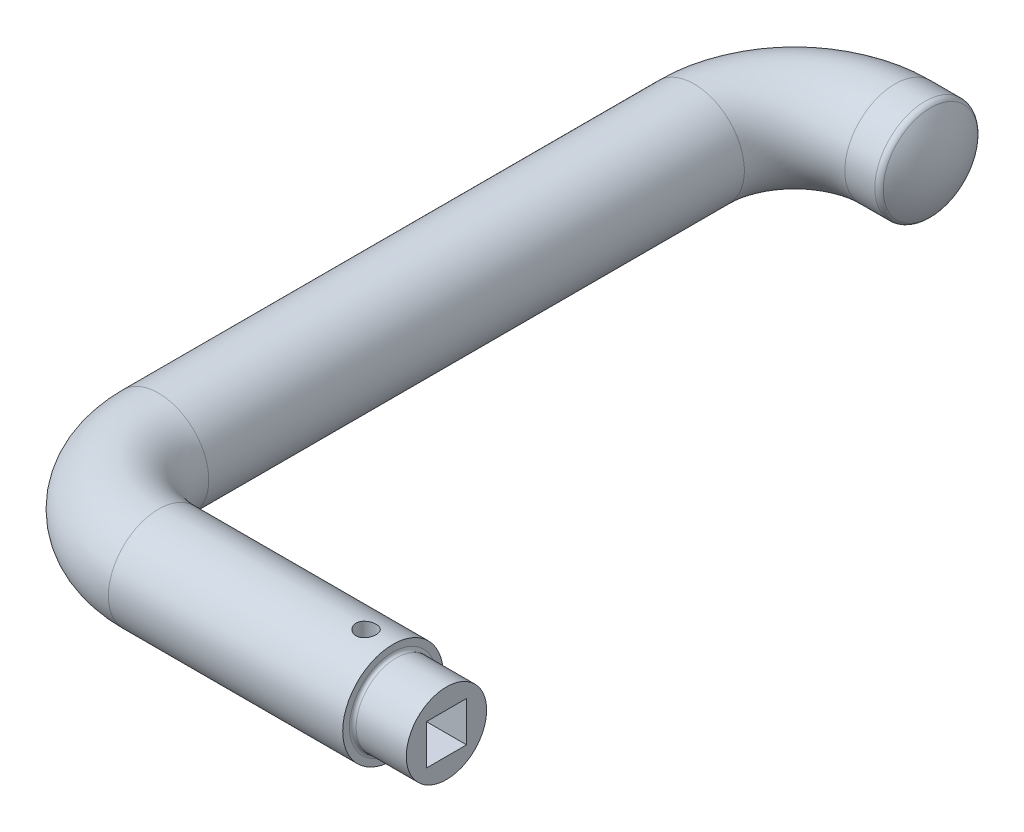
from build123d import *

# Parameters (mm, degrees)
SWEEP_THIN1_PROFILE_R   = 7.5
SWEEP_THIN1_PROFILE_R_2 = 6
CUT_EXTRUDE1_DEPTH      = 135.732141815
CUT_EXTRUDE1_DEPTH_BACK = 16
SKETCH65_W              = 6
SKETCH65_H              = 6
FILLET1_R               = 0.5
SKETCH66_R              = 1.5
CUT_EXTRUDE2_DEPTH      = 128.721376578
FILLET2_R               = 1


with BuildPart() as part:
    # Sweep-Thin1: sweep along a path in Sketch1
    with BuildLine(Plane(origin=(0, 0, 0), x_dir=(1, 0, 0), z_dir=(0, 1, 0))) as sweep_thin1_path:
        Line((0, 0), (-27, 0))
        ThreePointArc((-27, 0), (-37.606601718, 4.393398282), (-42, 15))
        Line((-42, 15), (-42, 95))
        ThreePointArc((-42, 95), (-37.606601718, 105.606601718), (-27, 110))
        Line((-27, 110), (-22, 110))
    # Sweep-Thin1 profile (on start of the path) → Sweep-Thin1 (sweep)
    with BuildSketch(Plane(origin=(0, 0, 0), x_dir=(0, 0, -1), z_dir=(-1, 0, 0))):
        Circle(SWEEP_THIN1_PROFILE_R)
        Circle(SWEEP_THIN1_PROFILE_R_2, mode=Mode.SUBTRACT)
    sweep(path=sweep_thin1_path.line)

    # Sketch63 → Revolve1 (revolve)
    with BuildSketch(Plane(origin=(0, 0, 0), x_dir=(1, 0, 0), z_dir=(0, 1, 0))):
        with BuildLine():
            Line((-22, 110), (-19.5, 110))
            ThreePointArc((-19.5, 110), (-20.141458774, 113.952847075), (-22, 117.5))
            Line((-22, 117.5), (-22, 110))
        make_face()
    revolve(axis=Axis((-22, 0, -110), (1, 0, 0)))

    # Sketch64 → Revolve3 (revolve)
    with BuildSketch(Plane(origin=(0, 0, 0), x_dir=(1, 0, 0), z_dir=(0, 1, 0)), mode=Mode.PRIVATE) as revolve3_sk:
        Polygon((0, 3), (0, 7.5), (8, 7.5), (8, 6), (16, 6), (16, 3), align=None)
    revolve(revolve3_sk.sketch.rotate(Axis((0, 0, 0), (1, 0, 0)), 180), axis=Axis((0, 0, 0), (1, 0, 0)))

    # Sketch65 → Cut-Extrude1 (cut, two sides: drawn at the far end of the back side and taken through both)
    with BuildSketch(Plane(origin=(16, 0, 0), x_dir=(0, 0, -1), z_dir=(1, 0, 0)).offset(-CUT_EXTRUDE1_DEPTH_BACK)):
        Rectangle(SKETCH65_W, SKETCH65_H)
    extrude(amount=CUT_EXTRUDE1_DEPTH + CUT_EXTRUDE1_DEPTH_BACK, mode=Mode.SUBTRACT)

    # Fillet1
    fillet1_edges = [part.edges().sort_by_distance(p)[0] for p in [
        (8, 0, -6),
    ]]
    fillet(fillet1_edges, radius=FILLET1_R)

    # Sketch66 → Cut-Extrude2 (cut, through all)
    with BuildSketch(Plane(origin=(0, 0, 0), x_dir=(1, 0, 0), z_dir=(0, 1, 0))):
        with Locations(Location((4, 0, 0), (0, 0, 180))):
            Circle(SKETCH66_R)
    extrude(amount=CUT_EXTRUDE2_DEPTH, mode=Mode.SUBTRACT)

    # Fillet2
    fillet2_edges = [part.edges().sort_by_distance(p)[0] for p in [
        (-22, -7.5, -110),
    ]]
    fillet(fillet2_edges, radius=FILLET2_R)


solid = part.part
